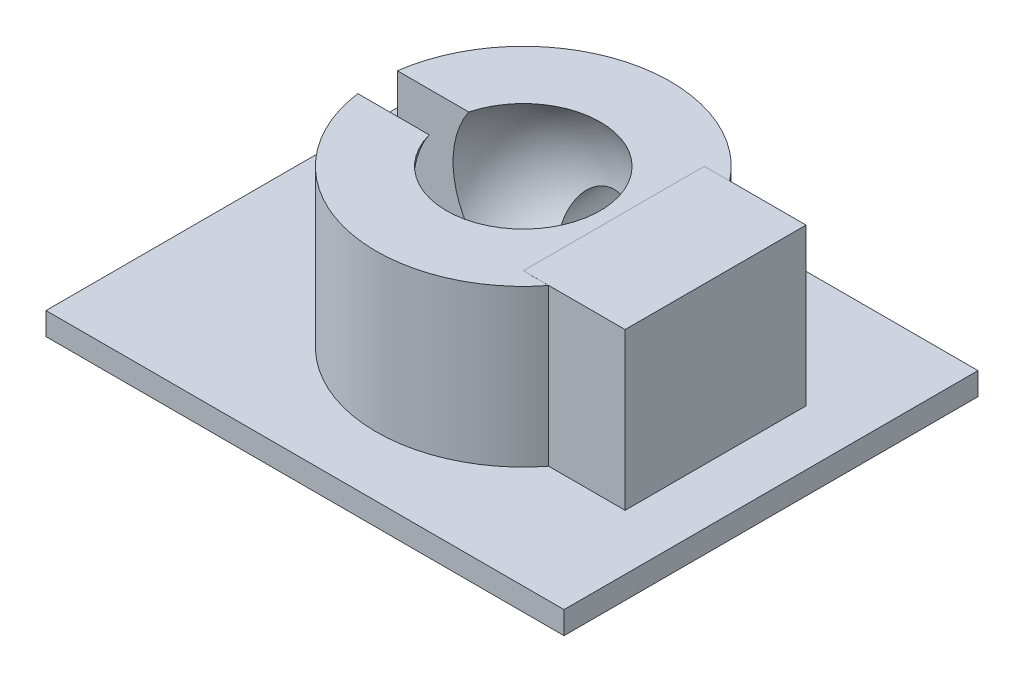
from build123d import *

# Parameters (mm, degrees)
SKETCH1_W               = 45.8
SKETCH1_H               = 36.6
BOSS_EXTRUDE1_DEPTH     = 2
SKETCH2_R               = 13
BOSS_EXTRUDE2_DEPTH     = 13.84
SKETCH5_W               = 9
SKETCH5_H               = 16
BOSS_EXTRUDE3_DEPTH     = 13.84249374
CUT_EXTRUDE2_REACH      = 36.016
SKETCH7_R               = 2.85
CUT_EXTRUDE3_DEPTH      = 1.75
CUT_EXTRUDE3_DEPTH_BACK = 1.75
SKETCH9_W               = 7.5
SKETCH9_H               = 13.84


with BuildPart() as part:
    # Sketch1 → Boss-Extrude1 (new body)
    with BuildSketch(Plane(origin=(0, 0, 0), x_dir=(1, 0, 0), z_dir=(0, 1, 0))):
        with Locations((-1, 0)):
            Rectangle(SKETCH1_W, SKETCH1_H)
    extrude(amount=BOSS_EXTRUDE1_DEPTH)

    # Sketch2 → Boss-Extrude2 (add)
    with BuildSketch(Plane(origin=(0, 2, 0), x_dir=(1, 0, 0), z_dir=(0, 1, 0))):
        Circle(SKETCH2_R)
    extrude(amount=BOSS_EXTRUDE2_DEPTH)

    # Sketch5 → Boss-Extrude3 (add)
    with BuildSketch(Plane(origin=(0, 2, 0), x_dir=(1, 0, 0), z_dir=(0, 1, 0))):
        with Locations((12.5, 0)):
            Rectangle(SKETCH5_W, SKETCH5_H)
    extrude(amount=BOSS_EXTRUDE3_DEPTH)

    # Sketch6 → Cut-Revolve1 (revolve, cut)
    with BuildSketch(Plane.XY):
        with BuildLine():
            ThreePointArc((0, 3.2), (8.15, 11.35), (0, 19.5))
            Line((0, 19.5), (0, 3.2))
        make_face()
    revolve(axis=Axis((0, 3.2, 0), (0, 1, 0)), mode=Mode.SUBTRACT)

    # Sketch7 → Cut-Extrude2 (cut, up to next)
    with BuildSketch(Plane.XY, mode=Mode.PRIVATE) as cut_extrude2_sk1:
        with Locations((0, 7.2)):
            Circle(SKETCH7_R)
    cut_extrude2_tool1 = extrude(cut_extrude2_sk1.sketch, amount=-CUT_EXTRUDE2_REACH, mode=Mode.PRIVATE) & part.part
    add(cut_extrude2_tool1.solids().sort_by_distance((0, 7.2, 0))[0], mode=Mode.SUBTRACT)

    # Sketch9 → Cut-Extrude3 (cut, two sides: drawn at the far end of the back side and taken through both)
    with BuildSketch(Plane.XY.offset(-CUT_EXTRUDE3_DEPTH_BACK)):
        with Locations((-9.25, 8.92)):
            Rectangle(SKETCH9_W, SKETCH9_H)
    extrude(amount=CUT_EXTRUDE3_DEPTH + CUT_EXTRUDE3_DEPTH_BACK, mode=Mode.SUBTRACT)


solid = part.part
